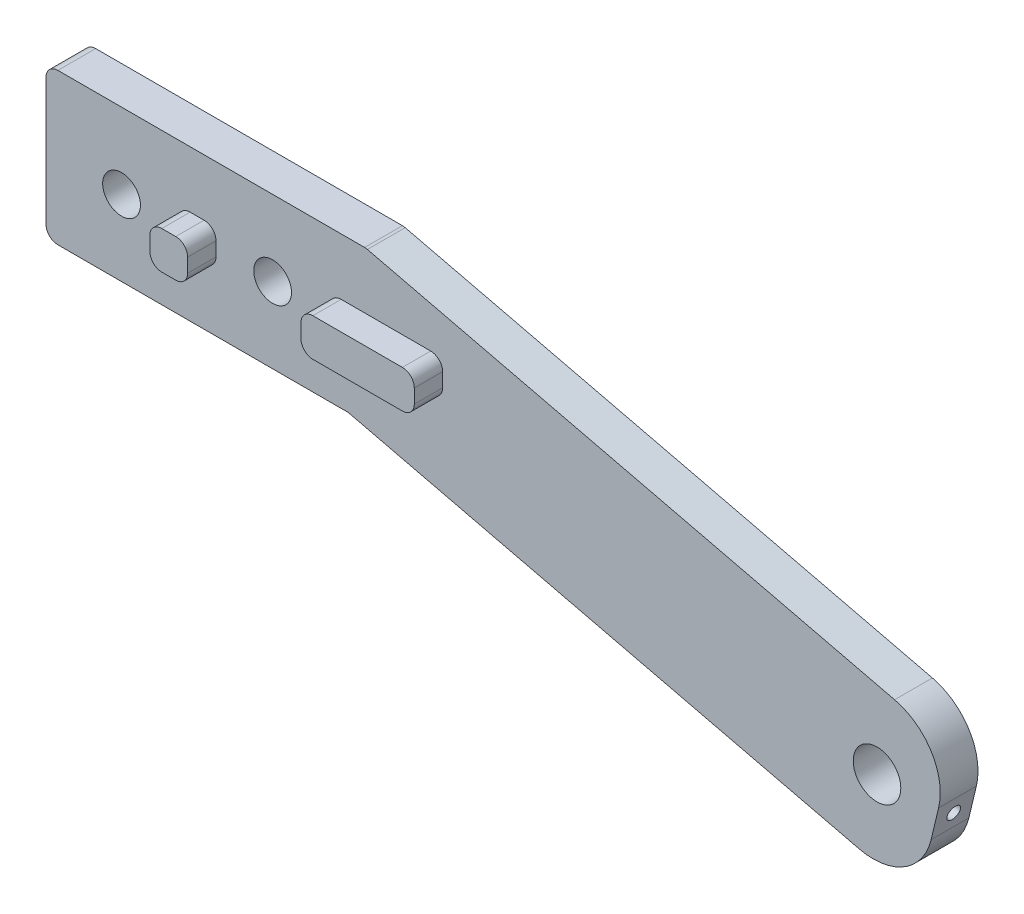
from build123d import *

# Parameters (mm, degrees)
SKETCH1_R               = 3.175
SKETCH1_R_2             = 4
BOSS_EXTRUDE1_DEPTH     = 6.35
CUT_EXTRUDE2_REACH      = 155.866
CUT_EXTRUDE2_END_RADIUS = 4
SKETCH3_R               = 1.1303
FILLET4_R               = 10
SKETCH4_W               = 6.35
SKETCH4_H               = 6.35
SKETCH4_W_2             = 19.05
BOSS_EXTRUDE2_DEPTH     = 4.7625
FILLET3_R               = 2


with BuildPart() as part:
    # Sketch1 → Boss-Extrude1 (new body)
    with BuildSketch(Plane.XY):
        Polygon((-38.1, -12.7), (-38.1, 12.7), (15.701735639, 12.7), (114.28491418, -10.930870684), (108.364133554, -35.631161305), (12.7, -12.7), align=None)
        with Locations((-25.4, 0)):
            Circle(SKETCH1_R, mode=Mode.SUBTRACT)
        Circle(SKETCH1_R, mode=Mode.SUBTRACT)
        with Locations((101.6, -20.95)):
            Circle(SKETCH1_R_2, mode=Mode.SUBTRACT)
    extrude(amount=BOSS_EXTRUDE1_DEPTH)

    # Cut-Extrude2: up to this cylinder (the profile starts outside it)
    cut_extrude2_end = Plane(origin=(101.6, -20.95, 3.175), z_dir=(0, 0, -1)) * Cylinder(CUT_EXTRUDE2_END_RADIUS, 320.732, mode=Mode.PRIVATE)
    # Sketch3 → Cut-Extrude2 (cut, up to the surface)
    with BuildSketch(Plane(origin=(110.552900462, -26.500071647, 0), x_dir=(0, 0, -1), z_dir=(0.9724523866696595, -0.23310159943784806, 0)), mode=Mode.PRIVATE) as cut_extrude2_sk1:
        with Locations(Location((-3.175, 3.310245002, 0), (0, 0, 90))):
            Circle(SKETCH3_R)
    cut_extrude2_tool1 = extrude(cut_extrude2_sk1.sketch, amount=-CUT_EXTRUDE2_REACH, mode=Mode.PRIVATE) - cut_extrude2_end
    add(cut_extrude2_tool1.solids().sort_by_distance((111.324524, -23.281016, 3.175))[0], mode=Mode.SUBTRACT)

    # Fillet4
    fillet4_edges = [part.edges().sort_by_distance(p)[0] for p in [
        (108.364133554, -35.631161305, 3.175),
        (114.28491418, -10.930870684, 3.175),
    ]]
    fillet(fillet4_edges, radius=FILLET4_R)

    # Sketch4 → Boss-Extrude2 (add)
    with BuildSketch(Plane.XY.offset(6.35)):
        with Locations((-12.7, 0)):
            Rectangle(SKETCH4_W, SKETCH4_H)
        with Locations((19.05, 0)):
            Rectangle(SKETCH4_W_2, SKETCH4_H)
    extrude(amount=BOSS_EXTRUDE2_DEPTH)

    # Fillet3
    fillet3_edges = [part.edges().sort_by_distance(p)[0] for p in [
        (12.7, -12.7, 3.175),
        (-38.1, -12.7, 3.175),
        (-38.1, 12.7, 3.175),
        (15.701735639, 12.7, 3.175),
        (-15.875, -3.175, 8.73125),
        (-9.525, -3.175, 8.73125),
        (-9.525, 3.175, 8.73125),
        (-15.875, 3.175, 8.73125),
        (9.525, -3.175, 8.73125),
        (28.575, -3.175, 8.73125),
        (28.575, 3.175, 8.73125),
        (9.525, 3.175, 8.73125),
    ]]
    fillet(fillet3_edges, radius=FILLET3_R)


solid = part.part
